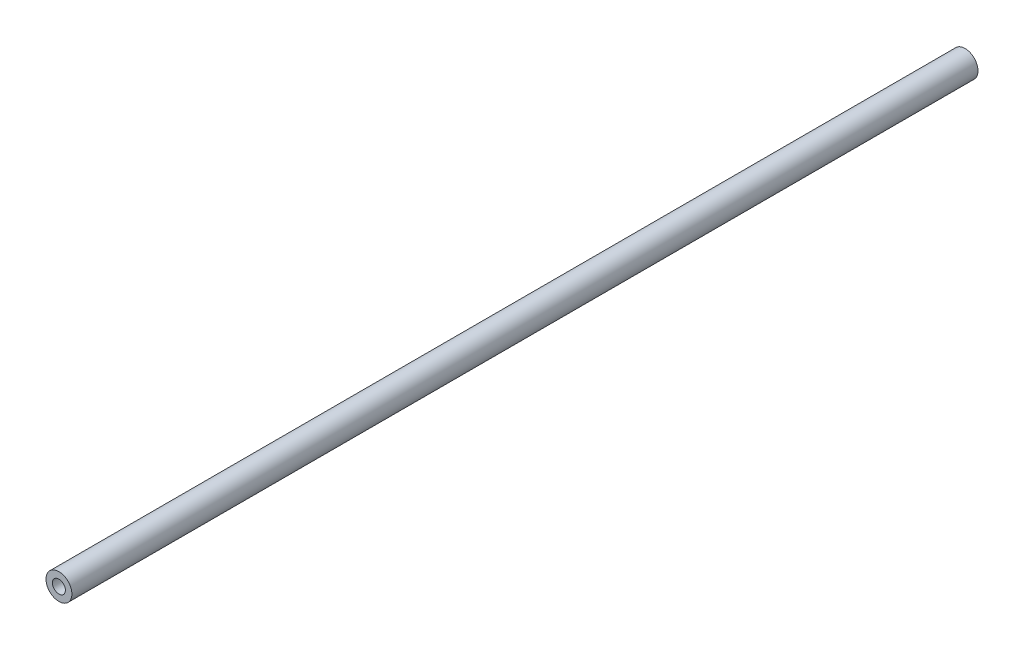
from build123d import *

# Parameters (mm, degrees)
SKETCH_1_R          = 4
EXTRUDE_1_DEPTH     = 280
SKETCH_2_R          = 2
CUT_EXTRUDE_1_DEPTH = 10
CUT_EXTRUDE_START   = -10
SKETCH_3_R          = 2
CUT_EXTRUDE_2_DEPTH = 10


with BuildPart() as part:
    # 草图1 → 凸台-拉伸1 (new body)
    with BuildSketch(Plane.XY):
        Circle(SKETCH_1_R)
    extrude(amount=EXTRUDE_1_DEPTH)

    # 草图2 → 切除-拉伸1 (cut)
    with BuildSketch(Plane.XY.offset(280)):
        Circle(SKETCH_2_R)
    extrude(amount=-CUT_EXTRUDE_1_DEPTH, mode=Mode.SUBTRACT)

    # 草图3 → 切除-拉伸2 (cut)
    with BuildSketch(Plane(origin=(0, 0, 0), x_dir=(-1, 0, 0), z_dir=(0, 0, -1)).offset(CUT_EXTRUDE_START)):
        with Locations(Location((0, 0, 0), (0, 0, 180))):
            Circle(SKETCH_3_R)
    extrude(amount=CUT_EXTRUDE_2_DEPTH, mode=Mode.SUBTRACT)


solid = part.part
